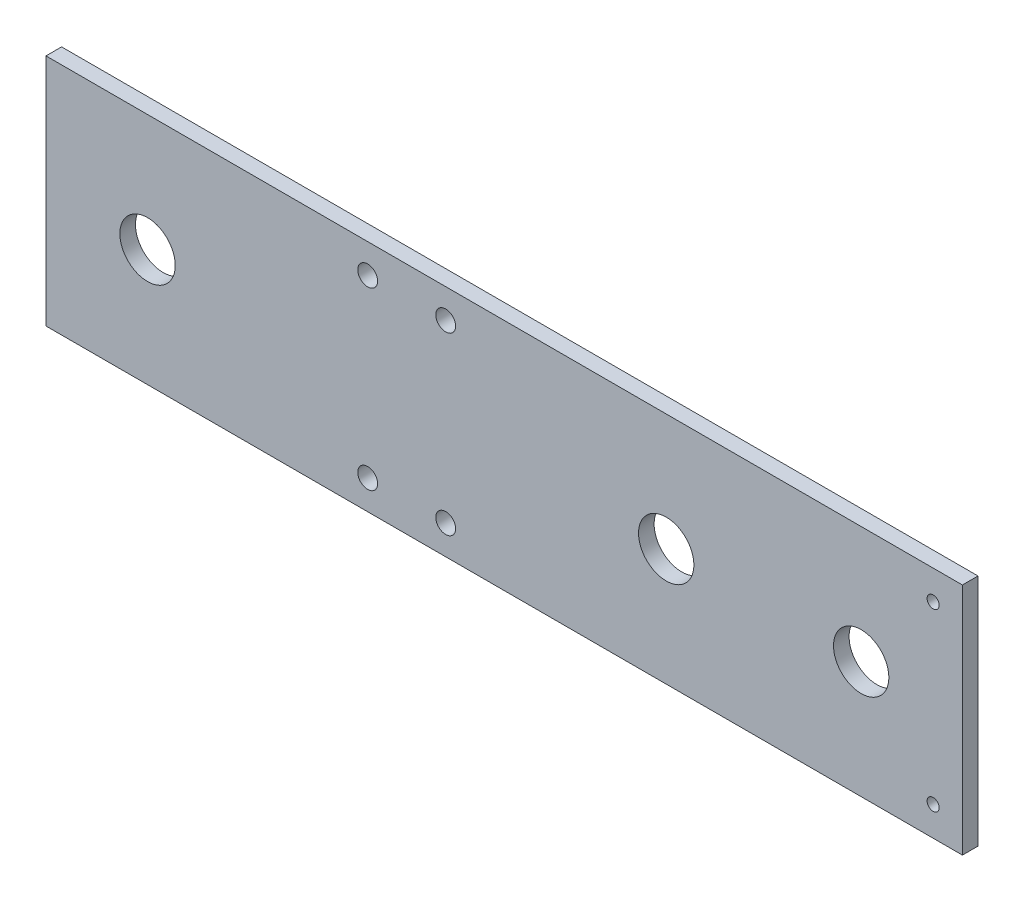
from build123d import *

# Parameters (mm, degrees)
SKETCH1_W           = 235
SKETCH1_H           = 60
SKETCH1_R           = 7.1
SKETCH1_R_2         = 1.55
SKETCH1_R_3         = 2.55
BOSS_EXTRUDE1_DEPTH = 4


with BuildPart() as part:
    # Sketch1 → Boss-Extrude1 (new body)
    with BuildSketch(Plane.XY):
        with Locations((-41.541275094, 0)):
            Rectangle(SKETCH1_W, SKETCH1_H)
        with Locations((-133, 0)):
            Circle(SKETCH1_R, mode=Mode.SUBTRACT)
        with Locations((50, 0)):
            Circle(SKETCH1_R, mode=Mode.SUBTRACT)
        Circle(SKETCH1_R, mode=Mode.SUBTRACT)
        with Locations((68.451377883, -22.492652976)):
            Circle(SKETCH1_R_2, mode=Mode.SUBTRACT)
        with Locations((68.451377883, 22.492652976)):
            Circle(SKETCH1_R_2, mode=Mode.SUBTRACT)
        with Locations((-56.548622117, -22.492652976)):
            Circle(SKETCH1_R_3, mode=Mode.SUBTRACT)
        with Locations((-56.548622117, 22.492652976)):
            Circle(SKETCH1_R_3, mode=Mode.SUBTRACT)
        with Locations((-76.548622117, -22.492652976)):
            Circle(SKETCH1_R_3, mode=Mode.SUBTRACT)
        with Locations((-76.548622117, 22.492652976)):
            Circle(SKETCH1_R_3, mode=Mode.SUBTRACT)
    extrude(amount=BOSS_EXTRUDE1_DEPTH)


solid = part.part
